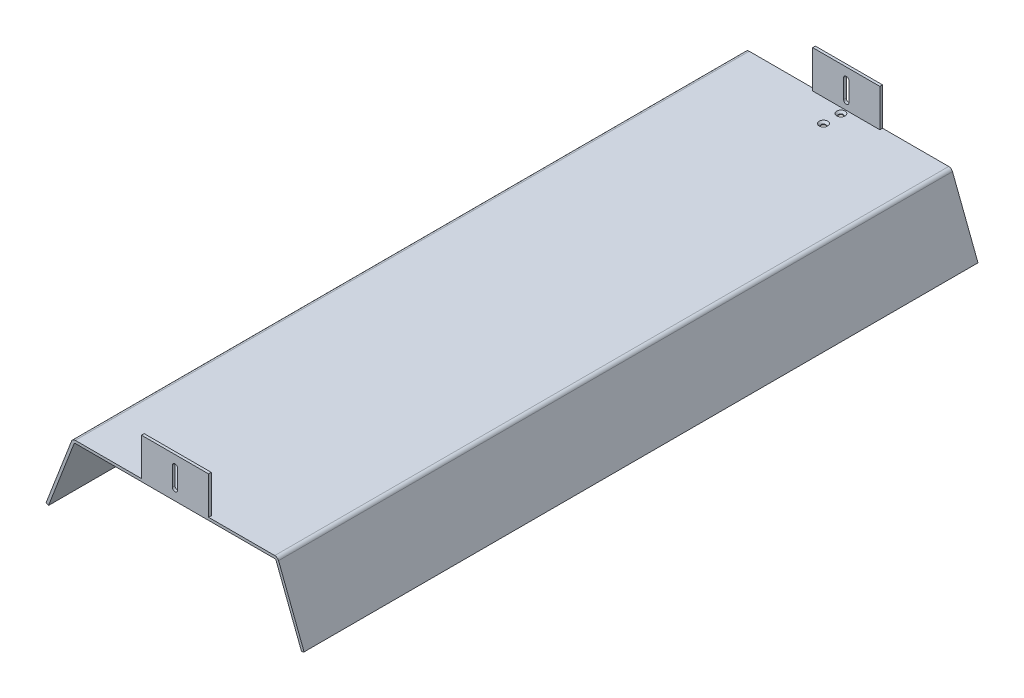
from build123d import *

# Parameters (mm, degrees)
EXTRUDE_THIN1_DEPTH                          = 502
SKETCH3_W                                    = 50
SKETCH3_H                                    = 30
BOSS_EXTRUDE1_DEPTH                          = 2
CSK_FOR_M3_COUNTERSUNK_FLAT_HEAD_SCR_2_COUNT = 2
CSK_FOR_M3_COUNTERSUNK_FLAT_HEAD_SCR_2_PITCH = 13


with BuildPart() as part:
    # Sketch1 → Extrude-Thin1 (new body)
    with BuildSketch(Plane.XY):
        with BuildLine():
            Line((94.25, -50), (75.246672681, -0.640708262))
            ThreePointArc((75.246672681, -0.640708262), (74.879445737, -0.175593626), (74.313447388, 0))
            Line((74.313447388, 0), (-74.313447388, 0))
            ThreePointArc((-74.313447388, 0), (-74.879445737, -0.175593626), (-75.246672681, -0.640708262))
            Line((-75.246672681, -0.640708262), (-94.25, -50))
            Line((-94.25, -50), (-96.116450586, -49.281416525))
            Line((-96.116450586, -49.281416525), (-77.113123267, 0.077875213))
            ThreePointArc((-77.113123267, 0.077875213), (-76.011442435, 1.473219121), (-74.313447388, 2))
            Line((-74.313447388, 2), (74.313447388, 2))
            ThreePointArc((74.313447388, 2), (76.011442435, 1.473219121), (77.113123267, 0.077875213))
            Line((77.113123267, 0.077875213), (96.116450586, -49.281416525))
            Line((96.116450586, -49.281416525), (94.25, -50))
        make_face()
    extrude(amount=EXTRUDE_THIN1_DEPTH)

    # Sketch3 → Boss-Extrude1 (add)
    with BuildSketch(Plane.XY.offset(502)):
        with Locations((0, 15)):
            Rectangle(SKETCH3_W, SKETCH3_H)
        with BuildLine():
            Line((2, 22), (2, 8))
            ThreePointArc((2, 8), (0, 6), (-2, 8))
            Line((-2, 8), (-2, 22))
            ThreePointArc((-2, 22), (0, 24), (2, 22))
        make_face(mode=Mode.SUBTRACT)
    extrude(amount=-BOSS_EXTRUDE1_DEPTH)

    # Mirror1: part across plane


with BuildPart() as part_1:
    add(part.part)
    add(part.part.mirror(Plane.XY.offset(251)))

    # Sketch5 → CSK for M3 Countersunk Flat Head Screw1 (revolve, cut)
    with BuildSketch(Plane(origin=(0, 2, 19), x_dir=(0, 0, 1), z_dir=(1, 0, 0))):
        Polygon((0, 0), (0, 26.021463052), (1.7, 25), (1.7, 1.45), (3.15, 0), align=None)
    csk_for_m3_countersunk_flat_head_screw1 = revolve(axis=Axis((0, 8.35, 19), (0, -1, 0)), mode=Mode.SUBTRACT)

    # CSK for M3 Countersunk Flat Head Scr 2: CSK for M3 Countersunk Flat Head Screw1 ×2
    with Locations(*[(0, 0, -i * CSK_FOR_M3_COUNTERSUNK_FLAT_HEAD_SCR_2_PITCH) for i in range(1, CSK_FOR_M3_COUNTERSUNK_FLAT_HEAD_SCR_2_COUNT)]):
        add(csk_for_m3_countersunk_flat_head_screw1, mode=Mode.SUBTRACT)

    # Mirror2: CSK for M3 Countersunk Flat Head Screw1 across plane
    add(csk_for_m3_countersunk_flat_head_screw1.mirror(Plane.XY.offset(251)), mode=Mode.SUBTRACT)

    # Mirror2 copy 1 sketch → Mirror2 copy 1 (revolve, cut)
    with BuildSketch(Plane(origin=(0, 2, 496), x_dir=(0, 0, -1), z_dir=(1, 0, 0))):
        Polygon((0, 0), (0, -26.021463052), (1.7, -25), (1.7, -1.45), (3.15, 0), align=None)
    revolve(axis=Axis((0, 8.35, 496), (0, 1, 0)), mode=Mode.SUBTRACT)


solid = part_1.part
